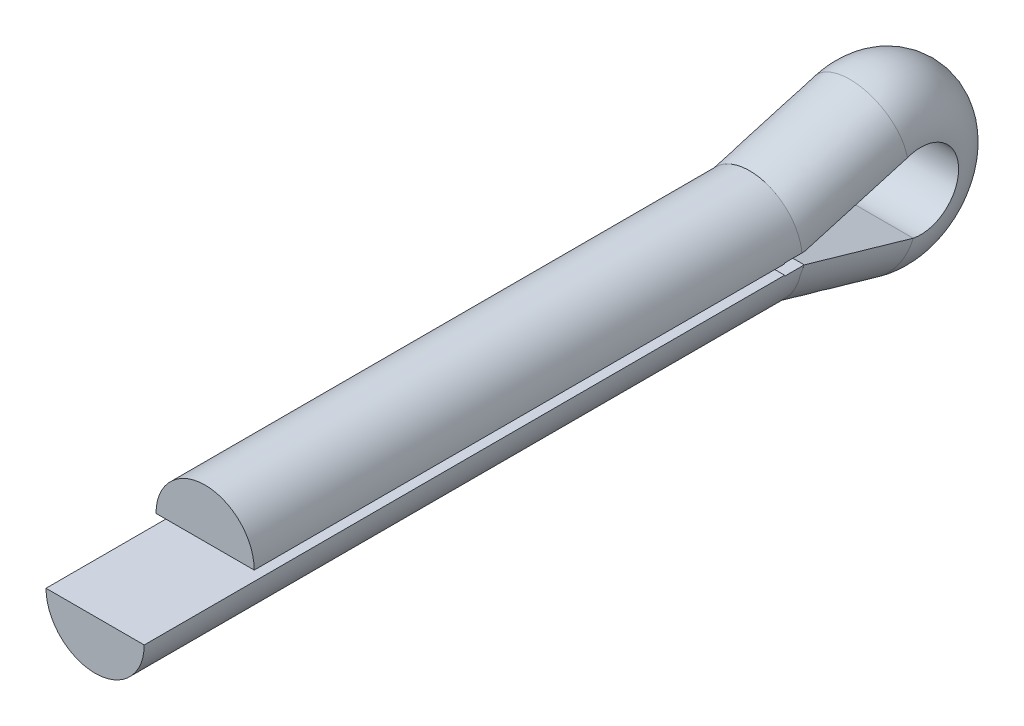
from build123d import *

# Parameters (mm, degrees)
SZKIC1_R                     = 2.5
DODANIE_WYCI_GNI_CIE1_DEPTH  = 0.31804017
SZKIC3_R                     = 2.5
DODANIE_WYCI_GNI_CIE2_DEPTH  = 0.31804017
SZKIC8_W                     = 2.5
SZKIC8_H                     = 0.31804017
SZKIC9_R                     = 2.5
DODANIE_WYCI_GNI_CIE3_DEPTH  = 0.31804017
SZKIC15_R                    = 2.5
DODANIE_WYCI_GNI_CIE4_DEPTH  = 0.31804017
SZKIC21_W                    = 2.5
SZKIC21_H                    = 0.31804017
SZKIC22_R                    = 2.5
DODANIE_WYCI_GNI_CIE5_DEPTH  = 0.31804017
SZKIC28_R                    = 2.5
DODANIE_WYCI_GNI_CIE6_DEPTH  = 0.31804017
SZKIC34_W                    = 2.5
SZKIC34_H                    = 0.31804017
DODANIE_WYCI_GNI_CIE7_DEPTH  = 0.31804017
DODANIE_WYCI_GNI_CIE8_DEPTH  = 27.657744359
DODANIE_WYCI_GNI_CIE9_DEPTH  = 0.31804017
DODANIE_WYCI_GNI_CIE10_DEPTH = 33.257744359
SZKIC54_W                    = 7.444504345
SZKIC54_H                    = 0.582583156
WYTNIJ_WYCI_GNI_CIE2_DEPTH   = 1


with BuildPart() as part:
    # Szkic1 → Dodanie-wyciągnięcie1 (new body)
    with BuildSketch(Plane.XY.offset(5)):
        with Locations((2.5, 0.25)):
            Circle(SZKIC1_R)
    extrude(amount=DODANIE_WYCI_GNI_CIE1_DEPTH)

    # Szkic3 → Dodanie-wyciągnięcie2 (add)
    with BuildSketch(Plane.XY.offset(5)):
        with Locations((2.5, -0.25)):
            Circle(SZKIC3_R)
    extrude(amount=DODANIE_WYCI_GNI_CIE2_DEPTH)

    # Szkic8 → Wycięcie-obrót2 (revolve, cut)
    with BuildSketch(Plane(origin=(0, -0.25, 0), x_dir=(1, 0, 0), z_dir=(0, 1, 0))):
        with Locations((3.75, -5.183235556)):
            Rectangle(SZKIC8_W, SZKIC8_H)
    revolve(axis=Axis((2.5, -0.25, 5.024215471), (0, 0, 1)), mode=Mode.SUBTRACT)

    # Szkic9 → Dodanie-wyciągnięcie3 (add)
    with BuildSketch(Plane.XY.offset(5.024215471)):
        with Locations(Location((2.5, 0.25, 0), (0, 0, 185.739170477))):
            Circle(SZKIC9_R)
    extrude(amount=DODANIE_WYCI_GNI_CIE3_DEPTH)

    # Szkic15 → Dodanie-wyciągnięcie4 (add)
    with BuildSketch(Plane.XY.offset(5)):
        with Locations((2.5, -0.25)):
            Circle(SZKIC15_R)
    extrude(amount=DODANIE_WYCI_GNI_CIE4_DEPTH)

    # Szkic21 → Wycięcie-obrót4 (revolve, cut)
    with BuildSketch(Plane(origin=(0, -0.25, 0), x_dir=(1, 0, 0), z_dir=(0, 1, 0))):
        with Locations((3.75, -5.183235556)):
            Rectangle(SZKIC21_W, SZKIC21_H)
    revolve(axis=Axis((2.5, -0.25, 5.024215471), (0, 0, 1)), mode=Mode.SUBTRACT)

    # Szkic22 → Dodanie-wyciągnięcie5 (add)
    with BuildSketch(Plane.XY.offset(5.024215471)):
        with Locations(Location((2.5, 0.25, 0), (0, 0, 185.739170477))):
            Circle(SZKIC22_R)
    extrude(amount=DODANIE_WYCI_GNI_CIE5_DEPTH)

    # Szkic28 → Dodanie-wyciągnięcie6 (add)
    with BuildSketch(Plane.XY.offset(5)):
        with Locations((2.5, -0.25)):
            Circle(SZKIC28_R)
    extrude(amount=DODANIE_WYCI_GNI_CIE6_DEPTH)

    # Szkic34 → Wycięcie-obrót6 (revolve, cut)
    with BuildSketch(Plane(origin=(0, -0.25, 0), x_dir=(1, 0, 0), z_dir=(0, 1, 0))):
        with Locations((3.75, -5.183235556)):
            Rectangle(SZKIC34_W, SZKIC34_H)
    revolve(axis=Axis((2.5, -0.25, 5.024215471), (0, 0, 1)), mode=Mode.SUBTRACT)

    # Szkic35 → Dodanie-wyciągnięcie7 (add)
    with BuildSketch(Plane.XY.offset(5)):
        with BuildLine():
            Line((5, 0.25), (0, 0.25))
            ThreePointArc((0, 0.25), (0.732233047, 2.017766953), (2.5, 2.75))
            ThreePointArc((2.5, 2.75), (4.267766953, 2.017766953), (5, 0.25))
        make_face()
    extrude(amount=DODANIE_WYCI_GNI_CIE7_DEPTH)

    # Szkic41 → Dodanie-wyciągnięcie8 (add)
    with BuildSketch(Plane.XY.offset(5.342255641)):
        with BuildLine():
            Line((5, 0.25), (0, 0.25))
            ThreePointArc((0, 0.25), (2.5, 2.75), (5, 0.25))
        make_face()
    extrude(amount=DODANIE_WYCI_GNI_CIE8_DEPTH)

    # Szkic42 → Dodanie-wyciągnięcie9 (add)
    with BuildSketch(Plane.XY.offset(5.024215471)):
        with BuildLine():
            Line((0, -0.25), (5, -0.25))
            ThreePointArc((5, -0.25), (4.267766953, -2.017766953), (2.5, -2.75))
            ThreePointArc((2.5, -2.75), (0.732233047, -2.017766953), (0, -0.25))
        make_face()
    extrude(amount=DODANIE_WYCI_GNI_CIE9_DEPTH)

    # Szkic43 → Dodanie-wyciągnięcie10 (add)
    with BuildSketch(Plane.XY.offset(5.342255641)):
        with BuildLine():
            Line((0, -0.25), (5, -0.25))
            ThreePointArc((5, -0.25), (2.5, -2.75), (0, -0.25))
        make_face()
    extrude(amount=DODANIE_WYCI_GNI_CIE10_DEPTH)

    # Wyciągnięcie po ścieżce1: sweep along a path in Szkic44
    with BuildLine(Plane(origin=(0, 0, 0), x_dir=(0, 0, -1), z_dir=(1, 0, 0))) as wyci_gni_cie_po_cie_ce1_path:
        Line((-5.560489768, 1.625), (0, 3.226324699))
        ThreePointArc((0, 3.226324699), (4.289893436, -0.0025), (0, -3.231324699))
        Line((0, -3.231324699), (-5.560489768, -1.63))
    # Szkic45 → Wyciągnięcie po ścieżce1 (sweep)
    with BuildSketch(Plane(origin=(0, -0.023604125, 5.269796381), x_dir=(-1, 0, 0), z_dir=(0, 0.17364817766693072, -0.984807753012208))):
        with BuildLine():
            Line((-3.646e-06, 0.226802786), (-4.999996354, 0.226802786))
            add(Edge.make_bspline(
                [(-3.646e-06, 0.226802786), (-0.004266201, 2.684617196), (-2.5, 2.684617196), (-4.995733799, 2.684617196), (-4.999996354, 0.226802786)],
                knots=[0.001707937, 0.001707937, 0.001707937, 1.570796327, 1.570796327, 3.139884716, 3.139884716, 3.139884716], degree=2, weights=[1, 0.70771037, 1, 0.70771037, 1]))
        make_face()
    sweep(path=wyci_gni_cie_po_cie_ce1_path.line)

    # Szkic54 → Wytnij-wyciągnięcie2 (cut)
    with BuildSketch(Plane(origin=(0, 0, 5), x_dir=(-1, 0, 0), z_dir=(0, 0, -1))):
        with Locations((-2.109396602, -0.0025)):
            Rectangle(SZKIC54_W, SZKIC54_H)
    extrude(amount=-WYTNIJ_WYCI_GNI_CIE2_DEPTH, mode=Mode.SUBTRACT)


solid = part.part
